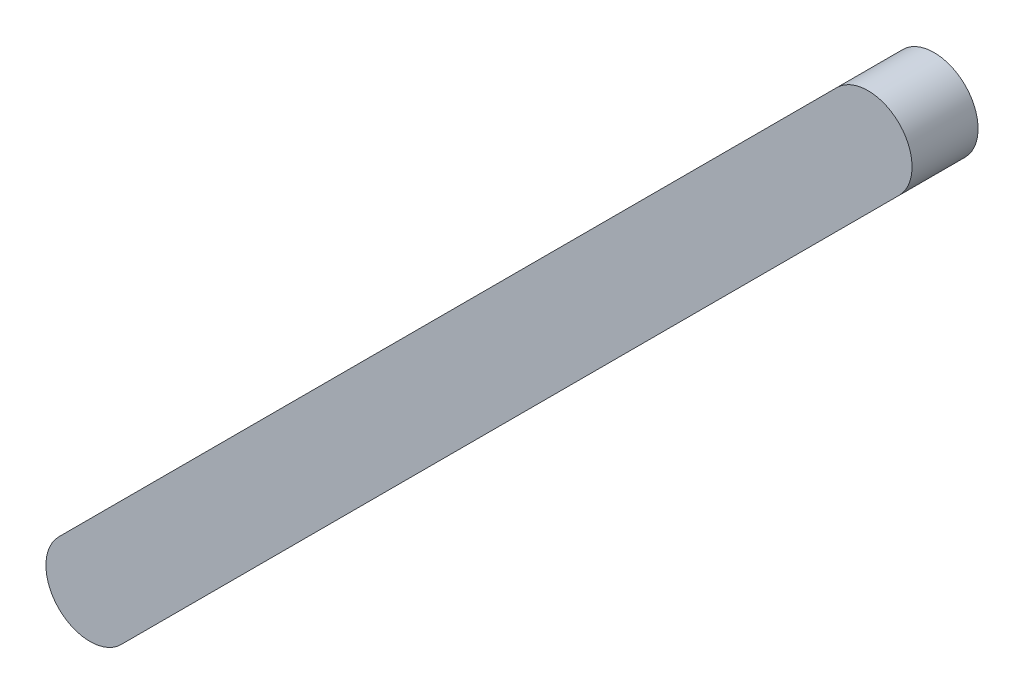
from build123d import *

# Parameters (mm, degrees)
BOSS_EXTRUDE1_DEPTH = 3


with BuildPart() as part:
    # Sketch1 → Boss-Extrude1 (new body)
    with BuildSketch(Plane.XY):
        with BuildLine():
            Line((-1.414213562, 1.414213562), (33.941125497, 36.769552622))
            ThreePointArc((33.941125497, 36.769552622), (36.769552622, 36.769552622), (36.769552622, 33.941125497))
            Line((36.769552622, 33.941125497), (1.414213562, -1.414213562))
            ThreePointArc((1.414213562, -1.414213562), (-1.414213562, -1.414213562), (-1.414213562, 1.414213562))
        make_face()
    extrude(amount=BOSS_EXTRUDE1_DEPTH)


solid = part.part
